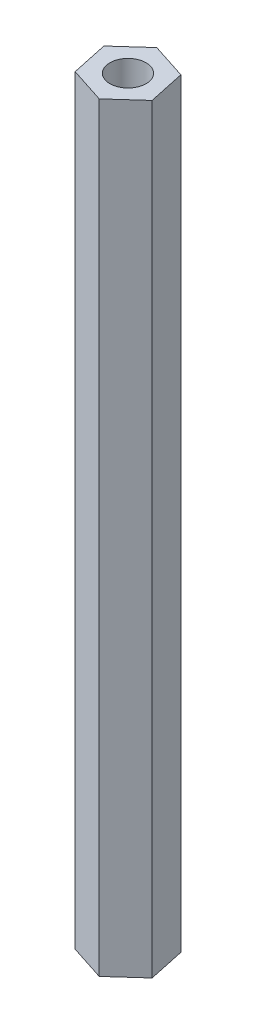
from build123d import *

# Parameters (mm, degrees)
RESSALTO_EXTRUS_O1_DEPTH                    = 66
FURO_ROSCADO_PARA_CONDU_TE_DE_M3X0_51_D     = 3.15
FURO_ROSCADO_PARA_CONDU_TE_DE_M3X0_51_DEPTH = 10
FURO_ROSCADO_PARA_CONDU_TE_DE_M3X0_51_TIP   = 0.946355475
FURO_ROSCADO_PARA_CONDU_TE_DE_M3X0_52_D     = 3.15
FURO_ROSCADO_PARA_CONDU_TE_DE_M3X0_52_DEPTH = 10
FURO_ROSCADO_PARA_CONDU_TE_DE_M3X0_52_TIP   = 0.946355475


with BuildPart() as part:
    # Esboço1 → Ressalto-extrusão1 (new body)
    with BuildSketch(Plane(origin=(0, 0, 0), x_dir=(1, 0, 0), z_dir=(0, 1, 0))):
        Polygon((3.092003015, -1.00100817), (2.412900012, 2.177249074), (-0.679103003, 3.178257244), (-3.092003015, 1.00100817), (-2.412900012, -2.177249074), (0.679103003, -3.178257244), align=None)
    extrude(amount=RESSALTO_EXTRUS_O1_DEPTH)

    # Furo roscado para conduíte de M3x0.51
    with Locations(Plane(origin=(0, 0, 0), x_dir=(-1, 0, 0), z_dir=(0, -1, 0))):
        with Locations((0, 0)):
            Hole(FURO_ROSCADO_PARA_CONDU_TE_DE_M3X0_51_D / 2, depth=FURO_ROSCADO_PARA_CONDU_TE_DE_M3X0_51_DEPTH)
            with Locations((0, 0, -(FURO_ROSCADO_PARA_CONDU_TE_DE_M3X0_51_DEPTH + FURO_ROSCADO_PARA_CONDU_TE_DE_M3X0_51_TIP / 2))):  # 118° drill point
                Cone(0, FURO_ROSCADO_PARA_CONDU_TE_DE_M3X0_51_D / 2, FURO_ROSCADO_PARA_CONDU_TE_DE_M3X0_51_TIP, mode=Mode.SUBTRACT)

    # Furo roscado para conduíte de M3x0.52
    with Locations(Plane(origin=(0, 66, 0), x_dir=(1, 0, 0), z_dir=(0, 1, 0))):
        with Locations((0, 0)):
            Hole(FURO_ROSCADO_PARA_CONDU_TE_DE_M3X0_52_D / 2, depth=FURO_ROSCADO_PARA_CONDU_TE_DE_M3X0_52_DEPTH)
            with Locations((0, 0, -(FURO_ROSCADO_PARA_CONDU_TE_DE_M3X0_52_DEPTH + FURO_ROSCADO_PARA_CONDU_TE_DE_M3X0_52_TIP / 2))):  # 118° drill point
                Cone(0, FURO_ROSCADO_PARA_CONDU_TE_DE_M3X0_52_D / 2, FURO_ROSCADO_PARA_CONDU_TE_DE_M3X0_52_TIP, mode=Mode.SUBTRACT)


solid = part.part
